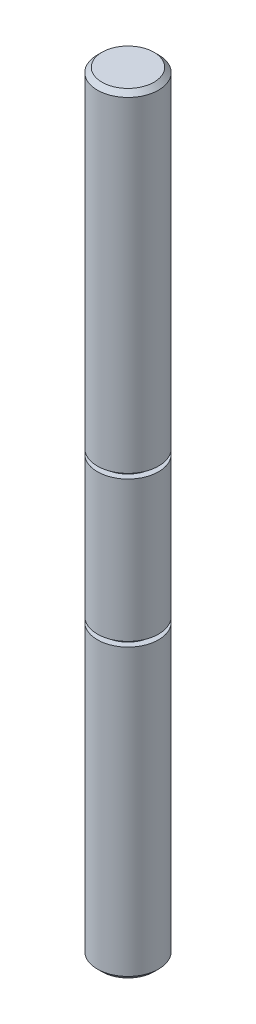
from build123d import *

# Parameters (mm, degrees)
SKETCH1_R           = 5
BOSS_EXTRUDE1_DEPTH = 126
CHAMFER1_SIZE       = 0.75
SKETCH2_W           = 1
SKETCH2_H           = 0.8


with BuildPart() as part:
    # Sketch1 → Boss-Extrude1 (new body)
    with BuildSketch(Plane(origin=(0, 0, 0), x_dir=(1, 0, 0), z_dir=(0, 1, 0))):
        with Locations(Location((0, 0, 0), (0, 0, 270))):
            Circle(SKETCH1_R)
    extrude(amount=BOSS_EXTRUDE1_DEPTH)

    # Chamfer1
    chamfer1_edges = [part.edges().sort_by_distance(p)[0] for p in [
        (0, 0, -5),
        (0, 126, -5),
    ]]
    chamfer(chamfer1_edges, length=CHAMFER1_SIZE)

    # Sketch2 → Cut-Revolve1 (revolve, cut)
    with BuildSketch(Plane.XY, mode=Mode.PRIVATE) as cut_revolve1_sk:
        with Locations((-4.5, 47.8)):
            Rectangle(SKETCH2_W, SKETCH2_H)
        with Locations((-4.5, 71.6)):
            Rectangle(SKETCH2_W, SKETCH2_H)
    revolve(cut_revolve1_sk.sketch.rotate(Axis((0, 111.50643277, 0), (0, -1, 0)), 270), axis=Axis((0, 111.50643277, 0), (0, -1, 0)), mode=Mode.SUBTRACT)


solid = part.part
